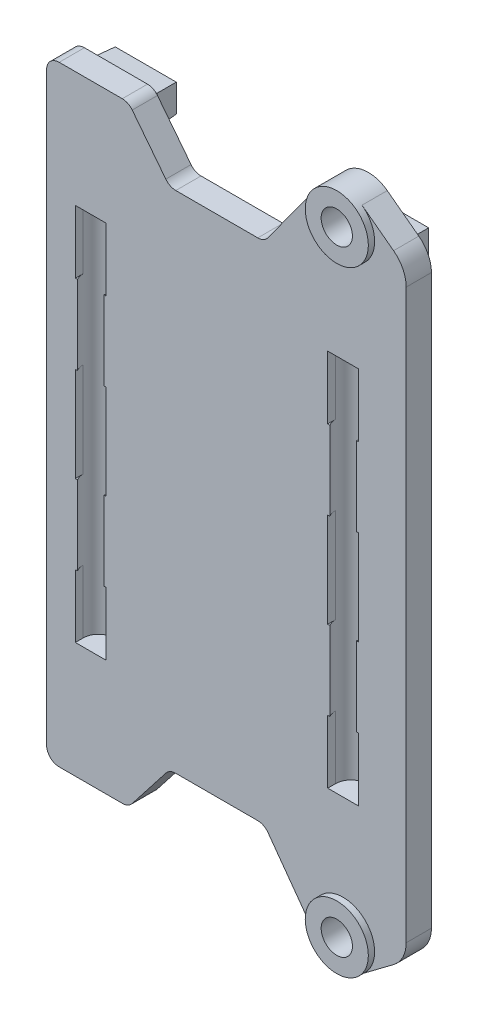
from build123d import *

# Parameters (mm, degrees)
SKETCH2_R                     = 1.575
BOSS_EXTRUDE1_DEPTH           = 2.54
SKETCH3_R                     = 3.175
SKETCH3_R_2                   = 1.575
BOSS_EXTRUDE2_DEPTH           = 0.635
SKETCH4_W                     = 6.35
SKETCH4_H                     = 3
BOSS_EXTRUDE3_DEPTH           = 1
SKETCH5_W                     = 6.35
SKETCH5_H                     = 3
BOSS_EXTRUDE4_DEPTH           = 2
BOSS_EXTRUDE4_DRAFT           = 3
BOSS_EXTRUDE4_PROFILE_2_DEPTH = 2
BOSS_EXTRUDE4_PROFILE_2_DRAFT = 3
SKETCH6_R                     = 1.55
CUT_EXTRUDE1_DEPTH            = 19.05
CUT_EXTRUDE2_START            = -0.788
SKETCH7_W                     = 3.1
SKETCH7_H                     = 6.35
SKETCH7_H_2                   = 4.7625
CUT_EXTRUDE2_DEPTH            = 0.788
CUT_EXTRUDE3_REACH            = 195.613
SKETCH8_W                     = 1.27
SKETCH8_H                     = 6.35
LPATTERN1_COUNT               = 2
LPATTERN1_PITCH               = 25.4


with BuildPart() as part:
    # Sketch2 → Boss-Extrude1 (new body)
    with BuildSketch(Plane.XY):
        with BuildLine():
            Line((186.055, 33.49625), (189.23, 31.115))
            ThreePointArc((189.23, 31.115), (190.164806331, 29.994903166), (190.5, 28.575))
            Line((190.5, 28.575), (190.5, 0))
            Line((190.5, 0), (154.305, 0))
            Line((154.305, 0), (154.305, 29.44))
            ThreePointArc((154.305, 29.44), (154.676974388, 30.338025612), (155.575, 30.71))
            Line((155.575, 30.71), (161.925, 30.71))
            ThreePointArc((161.925, 30.71), (162.482139282, 30.58126939), (162.926332297, 30.221174521))
            Line((162.926332297, 30.221174521), (166.306150062, 25.888825479))
            ThreePointArc((166.306150062, 25.888825479), (166.750343077, 25.52873061), (167.307482358, 25.4))
            Line((167.307482358, 25.4), (175.563715168, 25.4))
            ThreePointArc((175.563715168, 25.4), (176.141475824, 25.539030228), (176.592738534, 25.925680906))
            Line((176.592738534, 25.925680906), (181.577441586, 32.817047734))
            ThreePointArc((181.577441586, 32.817047734), (183.673830399, 34.095340236), (186.055, 33.49625))
        make_face()
        with Locations((184.15, 30.95625)):
            Circle(SKETCH2_R, mode=Mode.SUBTRACT)
    extrude(amount=BOSS_EXTRUDE1_DEPTH)

    # Sketch3 → Boss-Extrude2 (add)
    with BuildSketch(Plane.XY.offset(2.54)):
        with Locations(Location((184.15, 30.95625, 0), (0, 0, 144.120815799))):
            Circle(SKETCH3_R)
        with Locations((184.15, 30.95625)):
            Circle(SKETCH3_R_2, mode=Mode.SUBTRACT)
    extrude(amount=BOSS_EXTRUDE2_DEPTH)

    # Sketch4 → Boss-Extrude3 (add)
    with BuildSketch(Plane(origin=(0, 0, 0), x_dir=(-1, 0, 0), z_dir=(0, 0, -1))):
        with Locations((-184.15, 27.94)):
            Rectangle(SKETCH4_W, SKETCH4_H)
        with Locations((-158.75, 27.94)):
            Rectangle(SKETCH4_W, SKETCH4_H)
    extrude(amount=BOSS_EXTRUDE3_DEPTH)


with BuildPart() as boss_extrude4_tool:
    # Sketch5 → Boss-Extrude4 (with draft: the straight prism first)
    with BuildSketch(Plane(origin=(0, 0, -1), x_dir=(-1, 0, 0), z_dir=(0, 0, -1))):
        with Locations((-158.75, 27.94)):
            Rectangle(SKETCH5_W, SKETCH5_H)
    extrude(amount=BOSS_EXTRUDE4_DEPTH)
    # Boss-Extrude4: the draft: its side faces are tilted about the plane it starts from
    boss_extrude4_sides = [boss_extrude4_tool.faces().sort_by_distance(p)[0] for p in [
        (155.575, 27.94, -2),
        (158.75, 29.44, -2),
        (161.925, 27.94, -2),
        (158.75, 26.44, -2),
    ]]
    draft(boss_extrude4_sides, Plane(origin=(0, 0, -1), x_dir=(-1, 0, 0), z_dir=(0, 0, -1)), BOSS_EXTRUDE4_DRAFT)


with BuildPart() as part_1:
    add(part.part)

    # Boss-Extrude4: add boss_extrude4_tool
    add(boss_extrude4_tool.part)


with BuildPart() as boss_extrude4_profile_2_tool:
    # Sketch5 → Boss-Extrude4 profile 2 (with draft: the straight prism first)
    with BuildSketch(Plane(origin=(0, 0, -1), x_dir=(-1, 0, 0), z_dir=(0, 0, -1))):
        with Locations((-184.15, 27.94)):
            Rectangle(SKETCH5_W, SKETCH5_H)
    extrude(amount=BOSS_EXTRUDE4_PROFILE_2_DEPTH)
    # Boss-Extrude4 profile 2: the draft: its side faces are tilted about the plane it starts from
    boss_extrude4_profile_2_sides = [boss_extrude4_profile_2_tool.faces().sort_by_distance(p)[0] for p in [
        (180.975, 27.94, -2),
        (184.15, 29.44, -2),
        (187.325, 27.94, -2),
        (184.15, 26.44, -2),
    ]]
    draft(boss_extrude4_profile_2_sides, Plane(origin=(0, 0, -1), x_dir=(-1, 0, 0), z_dir=(0, 0, -1)), BOSS_EXTRUDE4_PROFILE_2_DRAFT)


with BuildPart() as part_2:
    add(part_1.part)

    # Boss-Extrude4 profile 2: add boss_extrude4_profile_2_tool
    add(boss_extrude4_profile_2_tool.part)

    # Sketch6 → Cut-Extrude1 (cut)
    with BuildSketch(Plane.XZ):
        with Locations((184.15, 1.752)):
            Circle(SKETCH6_R)
    cut_extrude1 = extrude(amount=-CUT_EXTRUDE1_DEPTH, mode=Mode.SUBTRACT)

    # Sketch7 → Cut-Extrude2 (cut)
    with BuildSketch(Plane.XY.offset(2.54).offset(CUT_EXTRUDE2_START)):
        with Locations((184.15, 15.875)):
            Rectangle(SKETCH7_W, SKETCH7_H)
        with Locations((184.15, 2.38125)):
            Rectangle(SKETCH7_W, SKETCH7_H_2)
    cut_extrude2 = extrude(amount=CUT_EXTRUDE2_DEPTH, mode=Mode.SUBTRACT)

    # Sketch8 → Cut-Extrude3 (cut, up to next)
    with BuildSketch(Plane.XY.offset(2.54), mode=Mode.PRIVATE) as cut_extrude3_sk1:
        with Locations((184.15, 3.175)):
            Rectangle(SKETCH8_W, SKETCH8_H)
    cut_extrude3_tool1 = extrude(cut_extrude3_sk1.sketch, amount=-CUT_EXTRUDE3_REACH, mode=Mode.PRIVATE) & part_2.part
    cut_extrude3 = cut_extrude3_tool1.solids().sort_by_distance((184.15, 3.175, 2.54))[0]
    add(cut_extrude3, mode=Mode.SUBTRACT)

    # LPattern1: Cut-Extrude1, Cut-Extrude2, Cut-Extrude3 ×2
    with Locations(*[(-i * LPATTERN1_PITCH, 0, 0) for i in range(1, LPATTERN1_COUNT)]):
        add(cut_extrude1, mode=Mode.SUBTRACT)
        add(cut_extrude2, mode=Mode.SUBTRACT)
        add(cut_extrude3, mode=Mode.SUBTRACT)

    # Mirror1: part across plane


with BuildPart() as part_3:
    add(part_2.part)
    add(part_2.part.mirror(Plane.ZX))


solid = part_3.part
